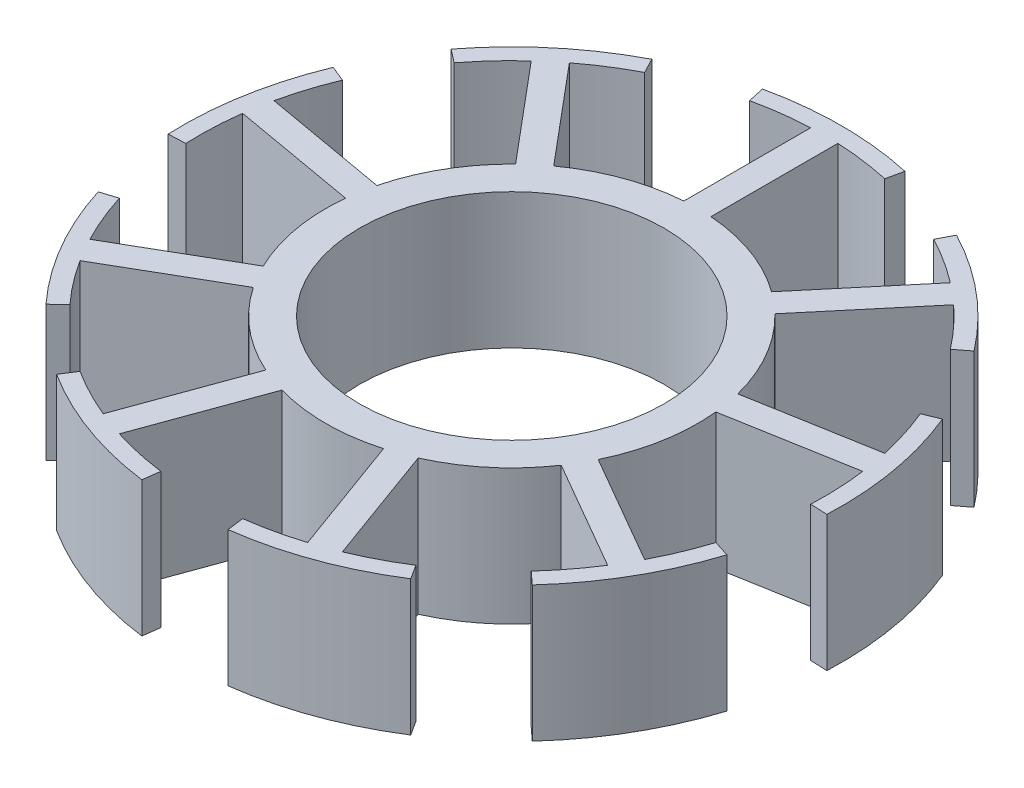
from build123d import *

# Parameters (mm, degrees)
SKETCH1_R           = 11
SKETCH1_R_2         = 9
BOSS_EXTRUDE1_DEPTH = 8
BOSS_EXTRUDE4_DEPTH = 8
CIRPATTERN2_COUNT   = 9


with BuildPart() as part:
    # Sketch1 → Boss-Extrude1 (new body)
    with BuildSketch(Plane(origin=(0, 0, 0), x_dir=(1, 0, 0), z_dir=(0, 1, 0))):
        with Locations(Location((0, 0, 0), (0, 0, 270))):
            Circle(SKETCH1_R)
        with Locations(Location((0, 0, 0), (0, 0, 270))):
            Circle(SKETCH1_R_2, mode=Mode.SUBTRACT)
    extrude(amount=BOSS_EXTRUDE1_DEPTH)

    # Sketch1<3> → Boss-Extrude4 (add)
    with BuildSketch(Plane(origin=(0, 0, 0), x_dir=(1, 0, 0), z_dir=(0, 1, 0))):
        with BuildLine():
            Line((-0.8, 18.469935747), (-0.8, 10.970870522))
            ThreePointArc((-0.8, 10.970870522), (0, 11), (0.8, 10.970870522))
            Line((0.8, 10.970870522), (0.8, 18.469935747))
            ThreePointArc((0.8, 18.469935747), (2.406716727, 18.329927471), (3.995116886, 18.050417379))
            Line((3.995116886, 18.050417379), (4.211218049, 19.026788357))
            ThreePointArc((4.211218049, 19.026788357), (0, 19.487253081), (-4.211218049, 19.026788357))
            Line((-4.211218049, 19.026788357), (-3.995116886, 18.050417379))
            ThreePointArc((-3.995116886, 18.050417379), (-2.406716727, 18.329927471), (-0.8, 18.469935747))
        make_face()
    boss_extrude4 = extrude(amount=BOSS_EXTRUDE4_DEPTH)

    # CirPattern2: Boss-Extrude4 ×9 about axis
    cirpattern2_axis = Axis((0, 0, 0), (0, 1, 0))
    for i in range(1, CIRPATTERN2_COUNT):
        add(boss_extrude4.rotate(cirpattern2_axis, i * 360 / CIRPATTERN2_COUNT))


solid = part.part
